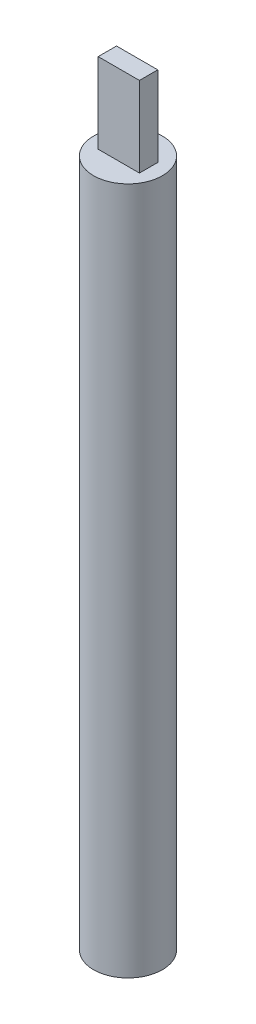
from build123d import *

# Parameters (mm, degrees)
SKETCH1_R           = 15
BOSS_EXTRUDE1_DEPTH = 300
SKETCH2_W           = 18
SKETCH2_H           = 8
BOSS_EXTRUDE2_DEPTH = 35


with BuildPart() as part:
    # Sketch1 → Boss-Extrude1 (new body)
    with BuildSketch(Plane(origin=(0, 0, 0), x_dir=(1, 0, 0), z_dir=(0, 1, 0))):
        with Locations(Location((0, 0, 0), (0, 0, 270))):
            Circle(SKETCH1_R)
    extrude(amount=BOSS_EXTRUDE1_DEPTH)

    # Sketch2 → Boss-Extrude2 (add)
    with BuildSketch(Plane(origin=(0, 300, 0), x_dir=(1, 0, 0), z_dir=(0, 1, 0))):
        Rectangle(SKETCH2_W, SKETCH2_H)
    extrude(amount=BOSS_EXTRUDE2_DEPTH)


solid = part.part
